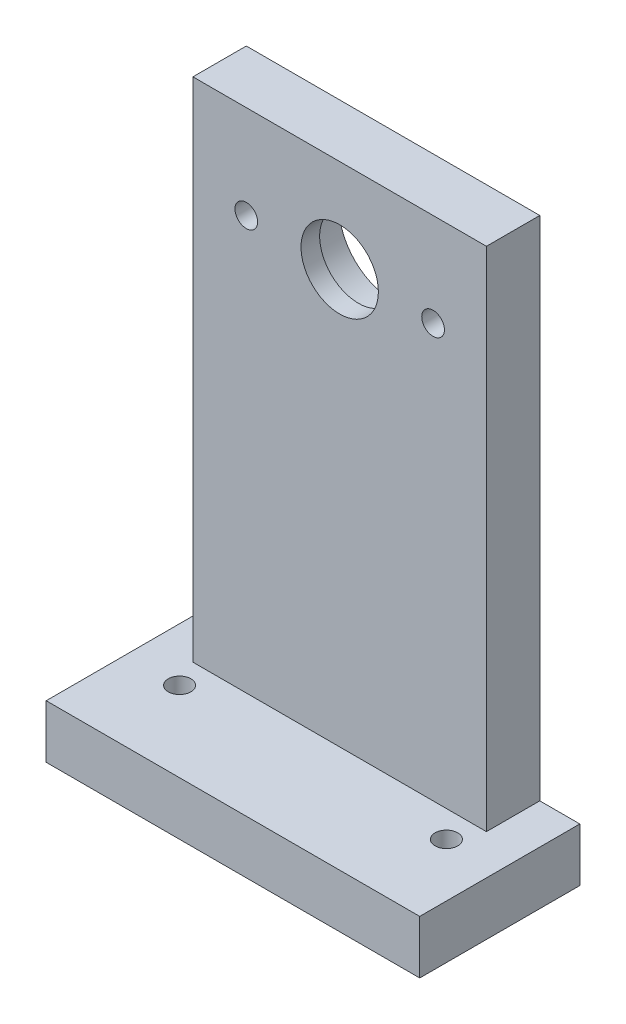
from build123d import *

# Parameters (mm, degrees)
SKETCH_1_W                                   = 56
SKETCH_1_H                                   = 8
FOOT_56X24X8_DEPTH                           = 24
SKETCH_2_W                                   = 44
SKETCH_2_H                                   = 84
TOWER_PIVOT_HEIGHT70_DEPTH                   = 8
SHAFT_ACCESS_AND_RETAINER_M3_DEPTH           = 92.738759529
SHAFT_ACCESS_AND_RETAINER_M3_DEPTH_BACK      = 92.738759529
SKETCH_3_R                                   = 5.8
SKETCH_3_R_2                                 = 1.7
SKETCH_4_R                                   = 8.1
F_625ZZ_POCKET_D16P2_DEPTH5P2_TEST_FIT_DEPTH = 5.2
FOOT_M3_THROUGH_DEPTH                        = 92.738759529
FOOT_M3_THROUGH_DEPTH_BACK                   = 92.738759529
SKETCH_5_R                                   = 1.7


with BuildPart() as part:
    # 草图1 → Foot_56x24x8 (new body)
    with BuildSketch(Plane.XY):
        with Locations((0, 4)):
            Rectangle(SKETCH_1_W, SKETCH_1_H)
    extrude(amount=FOOT_56X24X8_DEPTH)

    # 草图2 → Tower_pivot_height70 (add)
    with BuildSketch(Plane.XY):
        with Locations((0, 42)):
            Rectangle(SKETCH_2_W, SKETCH_2_H)
    extrude(amount=TOWER_PIVOT_HEIGHT70_DEPTH)

    # 草图3 → Shaft_access_and_retainer_M3 (cut, two sides: drawn at the far end of the back side and taken through both)
    with BuildSketch(Plane.XY.offset(-SHAFT_ACCESS_AND_RETAINER_M3_DEPTH_BACK)):
        with Locations((0, 70)):
            Circle(SKETCH_3_R)
        with Locations((-14, 70)):
            Circle(SKETCH_3_R_2)
        with Locations((14, 70)):
            Circle(SKETCH_3_R_2)
    extrude(amount=SHAFT_ACCESS_AND_RETAINER_M3_DEPTH + SHAFT_ACCESS_AND_RETAINER_M3_DEPTH_BACK, mode=Mode.SUBTRACT)

    # 草图4 → 625ZZ_pocket_D16p2_depth5p2_TEST_FIT (cut)
    with BuildSketch(Plane.XY):
        with Locations((0, 70)):
            Circle(SKETCH_4_R)
    extrude(amount=F_625ZZ_POCKET_D16P2_DEPTH5P2_TEST_FIT_DEPTH, mode=Mode.SUBTRACT)

    # 草图5 → Foot_M3_through (cut, two sides: drawn at the far end of the back side and taken through both)
    with BuildSketch(Plane(origin=(0, 0, 0), x_dir=(1, 0, 0), z_dir=(0, 1, 0)).offset(-FOOT_M3_THROUGH_DEPTH_BACK)):
        with Locations(Location((-20, -12, 0), (0, 0, 270))):
            Circle(SKETCH_5_R)
        with Locations(Location((20, -12, 0), (0, 0, 270))):
            Circle(SKETCH_5_R)
    extrude(amount=FOOT_M3_THROUGH_DEPTH + FOOT_M3_THROUGH_DEPTH_BACK, mode=Mode.SUBTRACT)


solid = part.part
